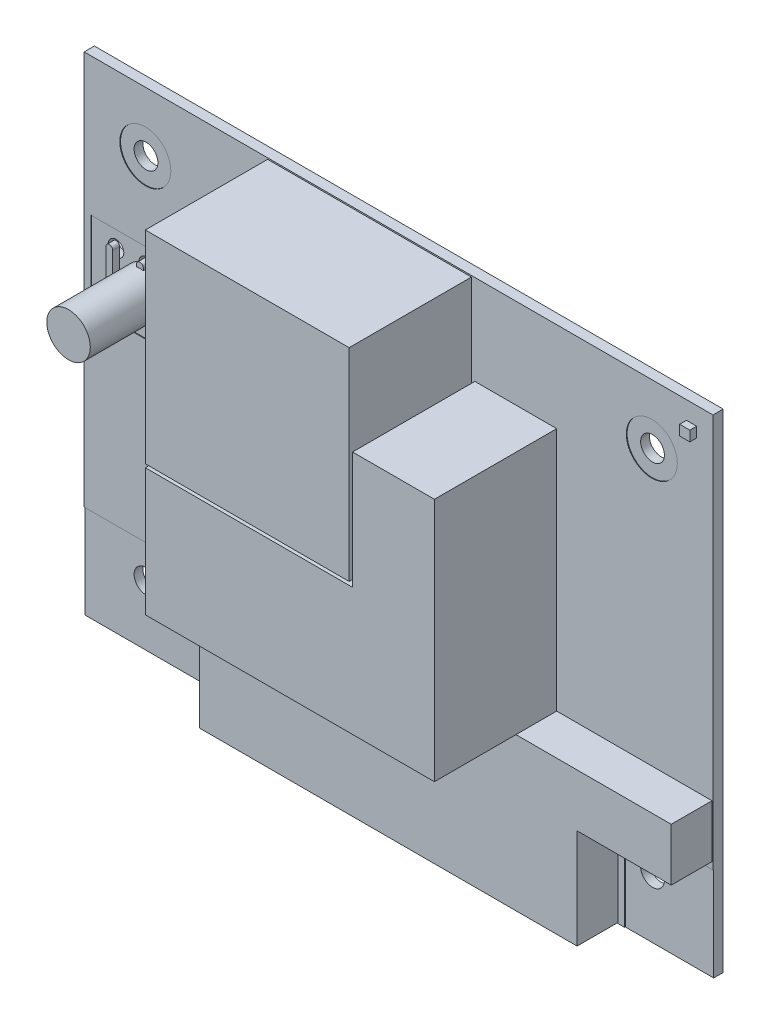
from build123d import *

# Parameters (mm, degrees)
ESQUISSE1_W             = 92.55
ESQUISSE1_H             = 71.82
BASE_EXTRUSION_DEPTH    = 1.5
ESQUISSE2_R             = 1.75
ENL_V_MAT_EXTRU_1_DEPTH = 61.036605709
ESQUISSE11_W            = 22
ESQUISSE11_H            = 13.81
ESQUISSE11_W_2          = 13
ENL_V_MAT_EXTRU_2_DEPTH = 0.1
EXTRUSION1_DEPTH        = 6
ESQUISSE13_W            = 30
ESQUISSE13_H            = 29.8
EXTRUSION2_DEPTH        = 18
ESQUISSE14_R            = 3.75
ENL_V_MAT_EXTRU_3_DEPTH = 0.1
ENL_V_START             = -0.1
ESQUISSE15_R            = 3.75
ENL_V_MAT_EXTRU_4_DEPTH = 0.1
ESQUISSE16_W            = 10
ESQUISSE16_H            = 15.5
EXTRUSION3_DEPTH        = 4
ESQUISSE17_W            = 1.4
ESQUISSE17_H            = 5
EXTRUSION4_DEPTH        = 2
ESQUISSE18_W            = 3
ESQUISSE18_H            = 12.063541947
ENL_V_MAT_EXTRU_5_DEPTH = 40
ESQUISSE19_R            = 1.75
ENL_V_MAT_EXTRU_6_DEPTH = 2
ESQUISSE20_W            = 1.5
ESQUISSE20_H            = 1.5
EXTRUSION5_DEPTH        = 1
ESQUISSE21_W            = 13
ESQUISSE21_H            = 11.8
ENL_V_MAT_EXTRU_7_DEPTH = 0.1
ESQUISSE22_R            = 1.15
ENL_V_MAT_EXTRU_8_DEPTH = 10.1
ESQUISSE23_R            = 3.2
EXTRUSION6_DEPTH        = 11.5
EXTRUSION7_DEPTH        = 1


with BuildPart() as part:
    # Esquisse1 → Base-Extrusion (new body)
    with BuildSketch(Plane.XY):
        with Locations((0, -2.31)):
            Rectangle(ESQUISSE1_W, ESQUISSE1_H)
    extrude(amount=-BASE_EXTRUSION_DEPTH)

    # Esquisse2 → Enlèv. mat.-Extru.1 (cut, through all)
    with BuildSketch(Plane.XY):
        with Locations((-37.275, 24.79)):
            Circle(ESQUISSE2_R)
        with Locations((37.275, 24.79)):
            Circle(ESQUISSE2_R)
        with Locations((-37.275, -29.41)):
            Circle(ESQUISSE2_R)
        with Locations((37.275, -29.41)):
            Circle(ESQUISSE2_R)
    extrude(amount=-ENL_V_MAT_EXTRU_1_DEPTH, mode=Mode.SUBTRACT)

    # Esquisse11 → Enlèv. mat.-Extru.2 (cut)
    with BuildSketch(Plane.XY):
        with Locations((-35.275, -31.315)):
            Rectangle(ESQUISSE11_W, ESQUISSE11_H)
        with Locations((39.775, -31.315)):
            Rectangle(ESQUISSE11_W_2, ESQUISSE11_H)
    extrude(amount=-ENL_V_MAT_EXTRU_2_DEPTH, mode=Mode.SUBTRACT)

    # Esquisse12 → Extrusion1 (add)
    with BuildSketch(Plane.XY):
        Polygon((32.275, -38.10398162), (32.275, -23.41), (46.128960316, -23.41), (46.128960316, -15.6492592), (-23.275, -15.6492592), (-23.275, -38.10398162), align=None)
    extrude(amount=EXTRUSION1_DEPTH)

    # Esquisse13 → Extrusion2 (add)
    with BuildSketch(Plane.XY):
        Polygon((-19.275, -15.6492592), (23.275, -15.6492592), (23.275, 20.3507408), (11.225, 20.3507408), (11.225, 3.1), (-19.275, 3.1), align=None)
        with Locations((-4.275, 18.5)):
            Rectangle(ESQUISSE13_W, ESQUISSE13_H)
    extrude(amount=EXTRUSION2_DEPTH)

    # Esquisse14 → Enlèv. mat.-Extru.3 (cut)
    with BuildSketch(Plane.XY):
        with Locations((-37.275, 24.79)):
            Circle(ESQUISSE14_R)
        with Locations((37.275, 24.79)):
            Circle(ESQUISSE14_R)
    extrude(amount=-ENL_V_MAT_EXTRU_3_DEPTH, mode=Mode.SUBTRACT)

    # Esquisse15 → Enlèv. mat.-Extru.4 (cut)
    with BuildSketch(Plane(origin=(0, 0, -1.5), x_dir=(-1, 0, 0), z_dir=(0, 0, -1)).offset(ENL_V_START)):
        with Locations(Location((-37.275, 24.79, 0), (0, 0, 180))):
            Circle(ESQUISSE15_R)
        with Locations(Location((37.275, 24.79, 0), (0, 0, 180))):
            Circle(ESQUISSE15_R)
        with Locations((37.275, -29.41)):
            Circle(ESQUISSE15_R)
        with Locations((-37.275, -29.41)):
            Circle(ESQUISSE15_R)
    extrude(amount=ENL_V_MAT_EXTRU_4_DEPTH, mode=Mode.SUBTRACT)

    # Esquisse16 → Extrusion3 (add)
    with BuildSketch(Plane(origin=(0, 0, -1.5), x_dir=(-1, 0, 0), z_dir=(0, 0, -1))):
        with Locations((19.275, 8.35)):
            Rectangle(ESQUISSE16_W, ESQUISSE16_H)
        with Locations((8.275, 8.35)):
            Rectangle(ESQUISSE16_W, ESQUISSE16_H)
        with Locations((-2.725, 8.35)):
            Rectangle(ESQUISSE16_W, ESQUISSE16_H)
        with Locations((-2.725, -25.9)):
            Rectangle(ESQUISSE16_W, ESQUISSE16_H)
        with Locations((8.275, -25.9)):
            Rectangle(ESQUISSE16_W, ESQUISSE16_H)
        with Locations((19.275, -25.9)):
            Rectangle(ESQUISSE16_W, ESQUISSE16_H)
    extrude(amount=EXTRUSION3_DEPTH)

    # Esquisse17 → Extrusion4 (add)
    with BuildSketch(Plane(origin=(0, 0, -1.5), x_dir=(-1, 0, 0), z_dir=(0, 0, -1))):
        with Locations((21.775, -1.9)):
            Rectangle(ESQUISSE17_W, ESQUISSE17_H)
        with Locations((19.275, -1.9)):
            Rectangle(ESQUISSE17_W, ESQUISSE17_H)
        with Locations((-2.725, -1.9)):
            Rectangle(ESQUISSE17_W, ESQUISSE17_H)
        with Locations((8.275, -1.9)):
            Rectangle(ESQUISSE17_W, ESQUISSE17_H)
        with Locations((16.775, -1.9)):
            Rectangle(ESQUISSE17_W, ESQUISSE17_H)
        with Locations((10.775, -1.9)):
            Rectangle(ESQUISSE17_W, ESQUISSE17_H)
        with Locations((5.775, -1.9)):
            Rectangle(ESQUISSE17_W, ESQUISSE17_H)
        with Locations((-0.225, -1.9)):
            Rectangle(ESQUISSE17_W, ESQUISSE17_H)
        with Locations((-5.225, -1.9)):
            Rectangle(ESQUISSE17_W, ESQUISSE17_H)
        with Locations((-5.225, -15.65)):
            Rectangle(ESQUISSE17_W, ESQUISSE17_H)
        with Locations((-0.225, -15.65)):
            Rectangle(ESQUISSE17_W, ESQUISSE17_H)
        with Locations((5.775, -15.65)):
            Rectangle(ESQUISSE17_W, ESQUISSE17_H)
        with Locations((10.775, -15.65)):
            Rectangle(ESQUISSE17_W, ESQUISSE17_H)
        with Locations((16.775, -15.65)):
            Rectangle(ESQUISSE17_W, ESQUISSE17_H)
        with Locations((8.275, -15.65)):
            Rectangle(ESQUISSE17_W, ESQUISSE17_H)
        with Locations((21.775, -15.65)):
            Rectangle(ESQUISSE17_W, ESQUISSE17_H)
        with Locations((-2.725, -15.65)):
            Rectangle(ESQUISSE17_W, ESQUISSE17_H)
        with Locations((19.275, -15.65)):
            Rectangle(ESQUISSE17_W, ESQUISSE17_H)
    extrude(amount=EXTRUSION4_DEPTH)

    # Esquisse18 → Enlèv. mat.-Extru.5 (cut)
    with BuildSketch(Plane(origin=(7.725, 0, 0), x_dir=(0, 0, -1), z_dir=(1, 0, 0))):
        with Locations((3, 15.631770974)):
            Rectangle(ESQUISSE18_W, ESQUISSE18_H)
        with Locations((3, -33.181770974)):
            Rectangle(ESQUISSE18_W, ESQUISSE18_H)
    extrude(amount=-ENL_V_MAT_EXTRU_5_DEPTH, mode=Mode.SUBTRACT)

    # Esquisse19 → Enlèv. mat.-Extru.6 (cut)
    with BuildSketch(Plane(origin=(0, 0, -5.5), x_dir=(-1, 0, 0), z_dir=(0, 0, -1))):
        with Locations((19.275, 13.290242265)):
            Circle(ESQUISSE19_R)
        with Locations((8.275, 13.290242265)):
            Circle(ESQUISSE19_R)
        with Locations((-2.725, 13.290242265)):
            Circle(ESQUISSE19_R)
        with Locations(Location((-2.725, -30.840242265, 0), (0, 0, 90))):
            Circle(ESQUISSE19_R)
        with Locations(Location((8.275, -30.840242265, 0), (0, 0, 90))):
            Circle(ESQUISSE19_R)
        with Locations(Location((19.275, -30.840242265, 0), (0, 0, 90))):
            Circle(ESQUISSE19_R)
    extrude(amount=-ENL_V_MAT_EXTRU_6_DEPTH, mode=Mode.SUBTRACT)

    # Esquisse20 → Extrusion5 (add)
    with BuildSketch(Plane.XY):
        with Locations((43.118260296, 30.210891785)):
            Rectangle(ESQUISSE20_W, ESQUISSE20_H)
    extrude(amount=EXTRUSION5_DEPTH)

    # Esquisse21 → Enlèv. mat.-Extru.7 (cut)
    with BuildSketch(Plane.XY):
        with Locations((-38.775, 7.4)):
            Rectangle(ESQUISSE21_W, ESQUISSE21_H)
    extrude(amount=-ENL_V_MAT_EXTRU_7_DEPTH, mode=Mode.SUBTRACT)

    # Esquisse22 → Enlèv. mat.-Extru.8 (cut)
    with BuildSketch(Plane.XY.offset(-0.1)):
        with Locations((-41.695, 10.8)):
            Circle(ESQUISSE22_R)
        with Locations((-41.675, 4.8)):
            Circle(ESQUISSE22_R)
        with Locations((-37.175, 10.8)):
            Circle(ESQUISSE22_R)
        with Locations((-37.175, 4.8)):
            Circle(ESQUISSE22_R)
    extrude(amount=-ENL_V_MAT_EXTRU_8_DEPTH, mode=Mode.SUBTRACT)

    # Esquisse23 → Extrusion6 (add)
    with BuildSketch(Plane.XY.offset(-0.1)):
        with Locations(Location((-37.175, 7.8, 0), (0, 0, 111.060240383))):
            Circle(ESQUISSE23_R)
    extrude(amount=EXTRUSION6_DEPTH)

    # Esquisse24 → Extrusion7 (add)
    with BuildSketch(Plane.XY.offset(-0.1)):
        with BuildLine():
            Line((-37.675, 11.3), (-37.675, 4.3))
            ThreePointArc((-37.675, 4.3), (-37.175, 3.8), (-36.675, 4.3))
            Line((-36.675, 4.3), (-36.675, 11.3))
            ThreePointArc((-36.675, 11.3), (-37.175, 11.8), (-37.675, 11.3))
        make_face()
        with BuildLine():
            Line((-42.175, 11.3), (-42.175, 4.3))
            ThreePointArc((-42.175, 4.3), (-41.675, 3.8), (-41.175, 4.3))
            Line((-41.175, 4.3), (-41.175, 11.3))
            ThreePointArc((-41.175, 11.3), (-41.675, 11.8), (-42.175, 11.3))
        make_face()
    extrude(amount=EXTRUSION7_DEPTH)


solid = part.part
